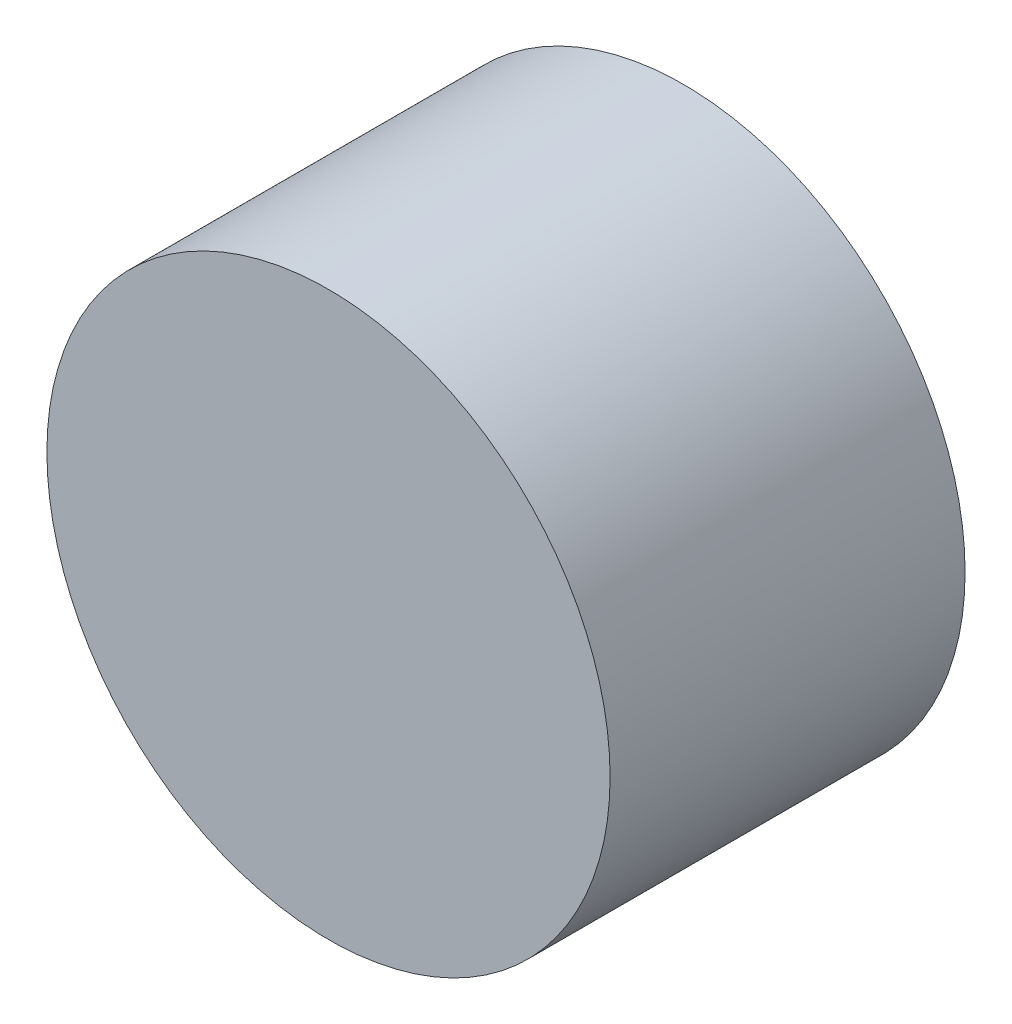
from build123d import *

# Parameters (mm, degrees)
SKETCH_1_R      = 23.797606223
EXTRUDE_1_DEPTH = 30


with BuildPart() as part:
    # Эскиз1 → Бобышка-Вытянуть1 (new body)
    with BuildSketch(Plane.XY):
        Circle(SKETCH_1_R)
    extrude(amount=EXTRUDE_1_DEPTH)


solid = part.part
